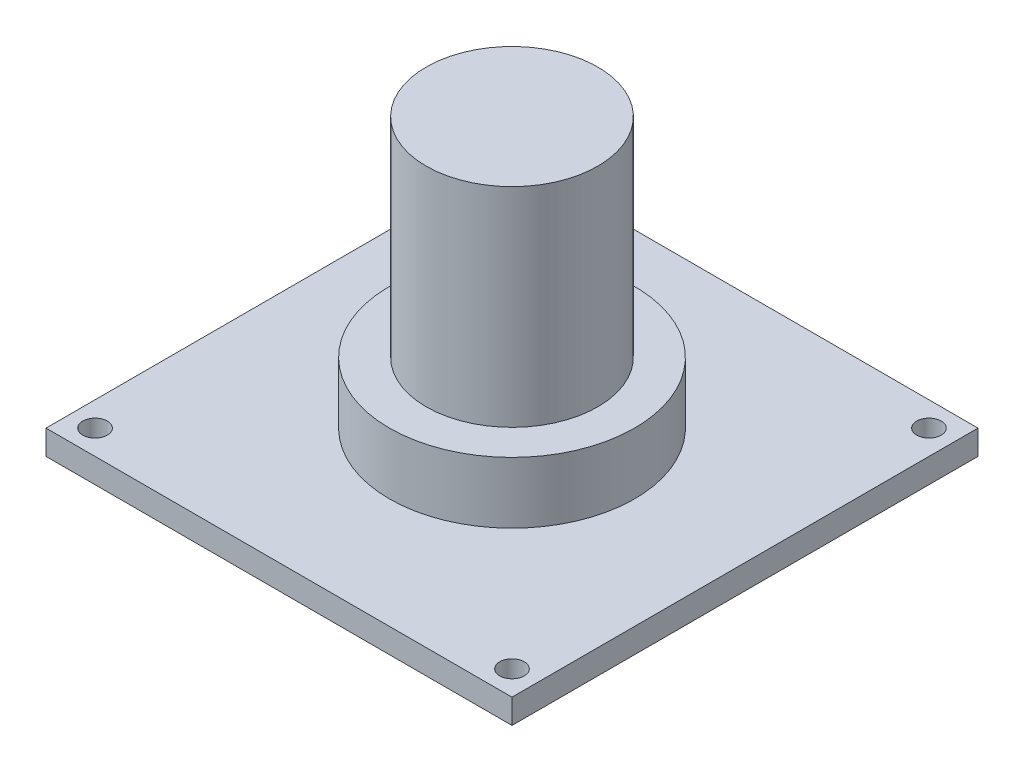
from build123d import *

# Parameters (mm, degrees)
SKETCH1_W           = 38
SKETCH1_H           = 38
SKETCH1_R           = 1
BOSS_EXTRUDE1_DEPTH = 2
SKETCH2_R           = 10
BOSS_EXTRUDE2_DEPTH = 5
SKETCH3_R           = 7
BOSS_EXTRUDE3_DEPTH = 17


with BuildPart() as part:
    # Sketch1 → Boss-Extrude1 (new body)
    with BuildSketch(Plane(origin=(0, 0, 0), x_dir=(1, 0, 0), z_dir=(0, 1, 0))):
        Rectangle(SKETCH1_W, SKETCH1_H)
        with Locations(Location((-17, 17, 0), (0, 0, 270))):
            Circle(SKETCH1_R, mode=Mode.SUBTRACT)
        with Locations(Location((17, 17, 0), (0, 0, 270))):
            Circle(SKETCH1_R, mode=Mode.SUBTRACT)
        with Locations(Location((17, -17, 0), (0, 0, 270))):
            Circle(SKETCH1_R, mode=Mode.SUBTRACT)
        with Locations(Location((-17, -17, 0), (0, 0, 270))):
            Circle(SKETCH1_R, mode=Mode.SUBTRACT)
    extrude(amount=BOSS_EXTRUDE1_DEPTH)

    # Sketch2 → Boss-Extrude2 (add)
    with BuildSketch(Plane(origin=(0, 2, 0), x_dir=(1, 0, 0), z_dir=(0, 1, 0))):
        with Locations(Location((0, 0, 0), (0, 0, 270))):
            Circle(SKETCH2_R)
    extrude(amount=BOSS_EXTRUDE2_DEPTH)

    # Sketch3 → Boss-Extrude3 (add)
    with BuildSketch(Plane(origin=(0, 7, 0), x_dir=(1, 0, 0), z_dir=(0, 1, 0))):
        with Locations(Location((0, 0, 0), (0, 0, 270))):
            Circle(SKETCH3_R)
    extrude(amount=BOSS_EXTRUDE3_DEPTH)


solid = part.part
